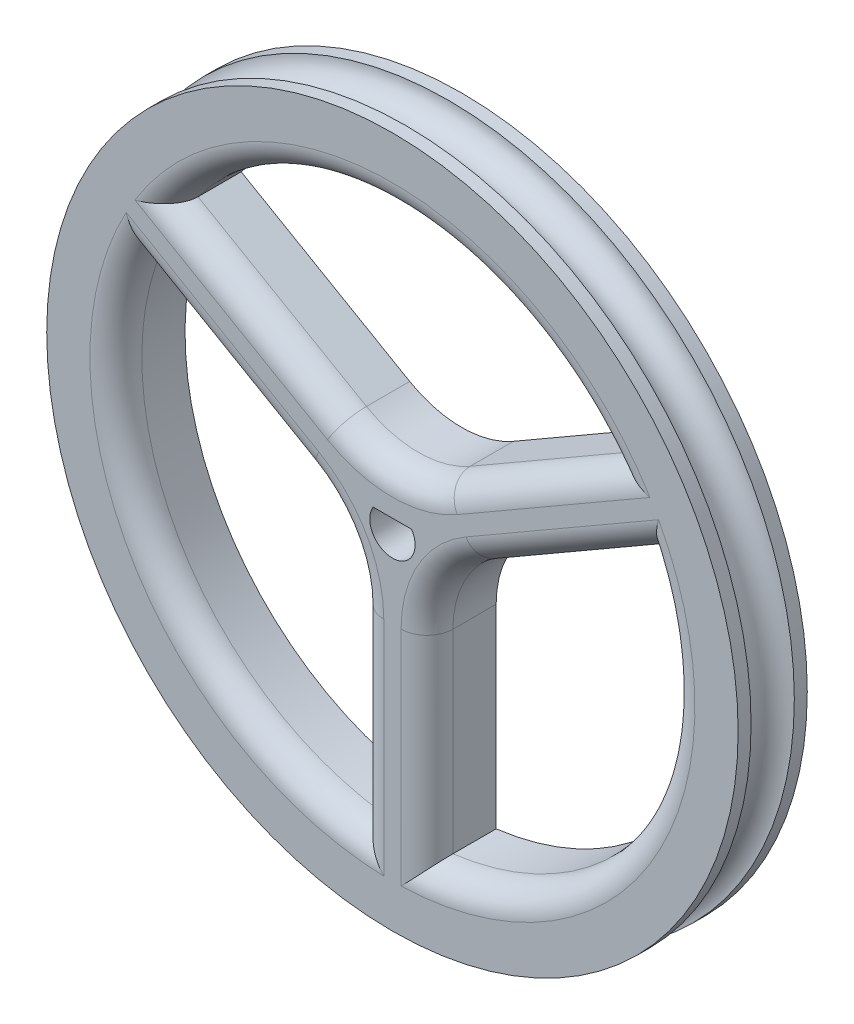
from build123d import *

# Parameters (mm, degrees)
SKETCH1_R           = 25.4
BOSS_EXTRUDE1_DEPTH = 5.08
FILLET4_R           = 7.62
FILLET5_R           = 1.905
SKETCH2_R           = 1.5875


with BuildPart() as part:
    # Sketch1 → Boss-Extrude1 (new body)
    with BuildSketch(Plane.XY):
        Circle(SKETCH1_R)
        with BuildLine():
            Line((2.54, -20.16062499), (2.54, -1.466469684))
            Line((2.54, -1.466469684), (18.729613398, 7.88060797))
            ThreePointArc((18.729613398, 7.88060797), (17.597636205, -10.16), (2.54, -20.16062499))
        make_face(mode=Mode.SUBTRACT)
        with BuildLine():
            Line((-2.54, -1.466469684), (-2.54, -20.16062499))
            ThreePointArc((-2.54, -20.16062499), (-17.597636205, -10.16), (-18.729613398, 7.88060797))
            Line((-18.729613398, 7.88060797), (-2.54, -1.466469684))
        make_face(mode=Mode.SUBTRACT)
        with BuildLine():
            Line((0, 2.932939367), (-16.189613398, 12.280017021))
            ThreePointArc((-16.189613398, 12.280017021), (0, 20.32), (16.189613398, 12.280017021))
            Line((16.189613398, 12.280017021), (0, 2.932939367))
        make_face(mode=Mode.SUBTRACT)
        with BuildLine():
            ThreePointArc((1.414212148, 0.8763), (0, -1.6637), (-1.414212148, 0.8763))
            Line((-1.414212148, 0.8763), (1.414212148, 0.8763))
        make_face(mode=Mode.SUBTRACT)
    extrude(amount=BOSS_EXTRUDE1_DEPTH)

    # Fillet4
    fillet4_edges = [part.edges().sort_by_distance(p)[0] for p in [
        (0, 2.932939367, 2.54),
        (2.54, -1.466469684, 2.54),
        (-2.54, -1.466469684, 2.54),
    ]]
    fillet(fillet4_edges, radius=FILLET4_R)

    # Fillet5
    fillet5_edges = [part.edges().sort_by_distance(p)[0] for p in [
        (9.999806699, 8.706330457, 5.08),
        (-9.999806699, 8.706330457, 5.08),
        (12.539806699, 4.306921406, 5.08),
        (3.560886423, -2.055878735, 5.08),
        (-2.54, -13.013251863, 5.08),
        (-3.560886423, -2.055878735, 5.08),
        (0, 20.32, 5.08),
        (-17.597636205, -10.16, 5.08),
        (17.597636205, -10.16, 5.08),
        (0, 4.11175747, 5.08),
        (2.54, -13.013251863, 5.08),
        (-12.539806699, 4.306921406, 5.08),
    ]]
    fillet(fillet5_edges, radius=FILLET5_R)

    # Sketch2 → Cut-Revolve1 (revolve, cut)
    with BuildSketch(Plane(origin=(0, 0, 0), x_dir=(0, 0, -1), z_dir=(1, 0, 0))):
        with Locations((-2.54, 25.4)):
            Circle(SKETCH2_R)
    revolve(axis=Axis((0, 0, 5.08), (0, 0, -1)), mode=Mode.SUBTRACT)


solid = part.part
